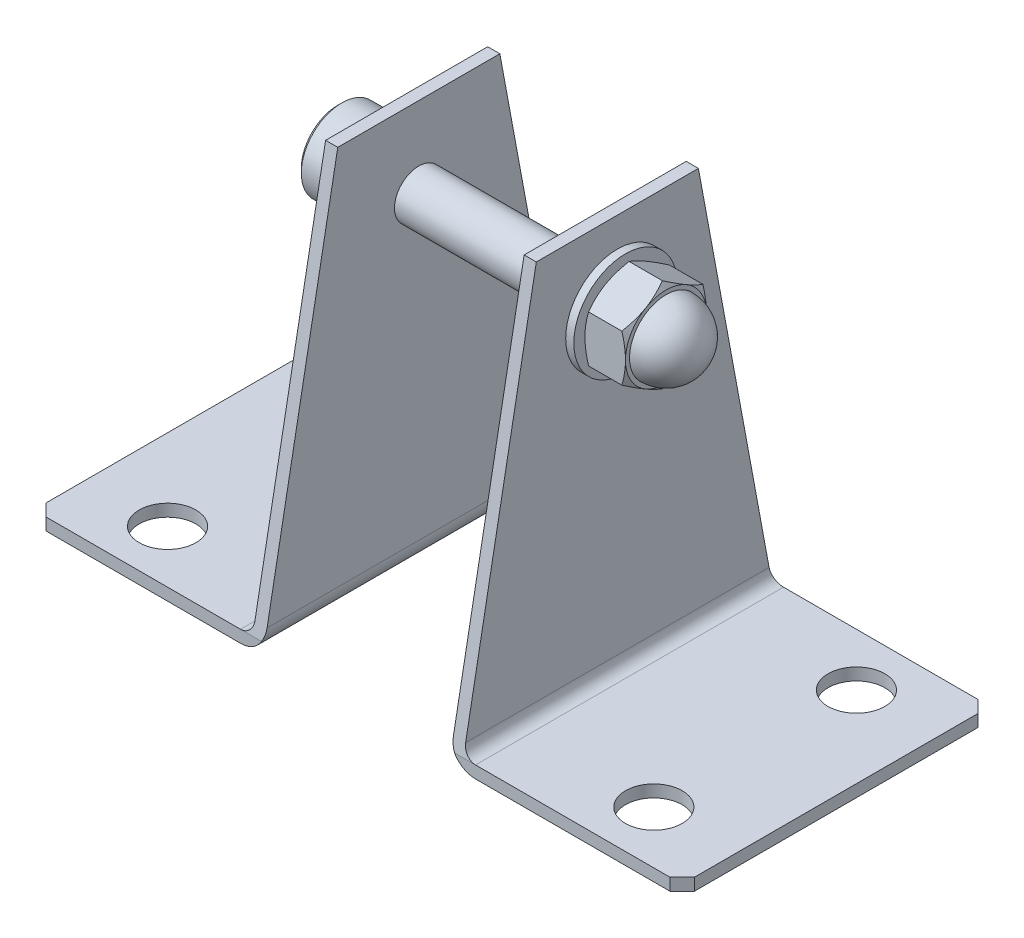
from build123d import *
from build123d.topology import SkipClean

# Parameters (mm, degrees)
BOSS_EXTRUDE1_DEPTH     = 19
BOSS_EXTRUDE1_2_DEPTH   = 19
CUT_EXTRUDE1_DEPTH      = 67.790717918
CUT_EXTRUDE1_DEPTH_BACK = 67.790717918
SKETCH3_R               = 3
CUT_EXTRUDE2_DEPTH      = 76.299402388
SKETCH4_R               = 3.5
CUT_EXTRUDE3_DEPTH      = 66.675337837
CHAMFER1_SIZE           = 1.5
CHAMFER2_SIZE           = 1.5
SKETCH5_W               = 1
SKETCH5_H               = 3.375
BOSS_EXTRUDE2_DEPTH     = 5
CUT_EXTRUDE4_DEPTH      = 3
CHAMFER3_SIZE           = 0.5


with BuildPart() as part:
    # Sketch1 → Boss-Extrude1 (new, symmetric)
    with BuildSketch(Plane.XY):
        with BuildLine():
            Line((-40, 0), (-14.5, 0))
            ThreePointArc((-14.5, 0), (-12.378679656, 0.878679656), (-11.5, 3))
            Line((-11.5, 3), (-11.5, 50))
            Line((-11.5, 50), (-13, 50))
            Line((-13, 50), (-13, 3))
            ThreePointArc((-13, 3), (-13.439339828, 1.939339828), (-14.5, 1.5))
            Line((-14.5, 1.5), (-40, 1.5))
            Line((-40, 1.5), (-40, 0))
        make_face()
    extrude(amount=BOSS_EXTRUDE1_DEPTH, both=True)


with BuildPart() as body_2:
    # Sketch1 → Boss-Extrude1 2 (new, symmetric)
    with BuildSketch(Plane.XY):
        with BuildLine():
            Line((13, 50), (11.5, 50))
            Line((11.5, 50), (11.5, 3))
            ThreePointArc((11.5, 3), (12.378679656, 0.878679656), (14.5, 0))
            Line((14.5, 0), (40, 0))
            Line((40, 0), (40, 1.5))
            Line((40, 1.5), (14.5, 1.5))
            ThreePointArc((14.5, 1.5), (13.439339828, 1.939339828), (13, 3))
            Line((13, 3), (13, 50))
        make_face()
    extrude(amount=BOSS_EXTRUDE1_2_DEPTH, both=True)


with BuildPart() as cut_extrude1_tool:
    # Sketch2 → Cut-Extrude1 (new, two sides: drawn at the far end of the back side and taken through both)
    with BuildSketch(Plane(origin=(0, 0, 0), x_dir=(0, 0, -1), z_dir=(1, 0, 0)).offset(-CUT_EXTRUDE1_DEPTH_BACK)):
        Polygon((-19, 50), (-10, 50), (-19, 1.5), align=None)
        Polygon((10, 50), (19, 50), (19, 1.5), align=None)
    extrude(amount=CUT_EXTRUDE1_DEPTH + CUT_EXTRUDE1_DEPTH_BACK)


with BuildPart() as part_1:
    add(part.part)

    # Cut-Extrude1: cut by cut_extrude1_tool
    add(cut_extrude1_tool.part, mode=Mode.SUBTRACT)


with BuildPart() as body_2_1:
    add(body_2.part)

    # Cut-Extrude1: cut by cut_extrude1_tool
    add(cut_extrude1_tool.part, mode=Mode.SUBTRACT)


with BuildPart() as cut_extrude2_tool:
    # Sketch3 → Cut-Extrude2 (new, through all)
    with BuildSketch(Plane(origin=(13, 0, 0), x_dir=(0, 0, -1), z_dir=(1, 0, 0))):
        with Locations((0, 40)):
            Circle(SKETCH3_R)
    extrude(amount=-CUT_EXTRUDE2_DEPTH)


with BuildPart() as part_2:
    add(part_1.part)

    # Cut-Extrude2: cut by cut_extrude2_tool
    add(cut_extrude2_tool.part, mode=Mode.SUBTRACT)


with BuildPart() as body_2_2:
    add(body_2_1.part)

    # Cut-Extrude2: cut by cut_extrude2_tool
    add(cut_extrude2_tool.part, mode=Mode.SUBTRACT)


with BuildPart() as cut_extrude3_tool:
    # Sketch4 → Cut-Extrude3 (new, through all)
    with BuildSketch(Plane(origin=(0, 1.5, 0), x_dir=(1, 0, 0), z_dir=(0, 1, 0))):
        with Locations(Location((-30, 12.5, 0), (0, 0, 270))):
            Circle(SKETCH4_R)
        with Locations(Location((-30, -12.5, 0), (0, 0, 270))):
            Circle(SKETCH4_R)
        with Locations(Location((30, 12.5, 0), (0, 0, 270))):
            Circle(SKETCH4_R)
        with Locations(Location((30, -12.5, 0), (0, 0, 270))):
            Circle(SKETCH4_R)
    extrude(amount=-CUT_EXTRUDE3_DEPTH)


with BuildPart() as part_3:
    add(part_2.part)

    # Cut-Extrude3: cut by cut_extrude3_tool
    add(cut_extrude3_tool.part, mode=Mode.SUBTRACT)

    # Chamfer1
    chamfer1_edges = [part_3.edges().sort_by_distance(p)[0] for p in [
        (-40, 0.75, -19),
        (-40, 0.75, 19),
    ]]
    chamfer(chamfer1_edges, length=CHAMFER1_SIZE)



with BuildPart() as body_2_3:
    add(body_2_2.part)

    # Cut-Extrude3: cut by cut_extrude3_tool
    add(cut_extrude3_tool.part, mode=Mode.SUBTRACT)

    # Chamfer2
    chamfer2_edges = [body_2_3.edges().sort_by_distance(p)[0] for p in [
        (40, 0.75, 19),
        (40, 0.75, -19),
    ]]
    chamfer(chamfer2_edges, length=CHAMFER2_SIZE)


with BuildPart() as part_4:
    with SkipClean():  # the faces are left unmerged after this step: merging them gives an invalid solid
        add(part_3.part)

        add(body_2_3.part)  # Revolve1 merges body 2
        # Sketch5 → Revolve1 (revolve)
        with BuildSketch(Plane.XY, mode=Mode.PRIVATE) as revolve1_sk:
            with Locations((-13.5, 44.6875)):
                Rectangle(SKETCH5_W, SKETCH5_H)
            with Locations((13.5, 44.6875)):
                Rectangle(SKETCH5_W, SKETCH5_H)
        revolve(revolve1_sk.sketch.rotate(Axis((-14, 40, 0), (1, 0, 0)), 90), axis=Axis((-14, 40, 0), (1, 0, 0)))


with BuildPart() as body_2_2_1:
    # Sketch6 → Revolve2 (revolve)
    with BuildSketch(Plane.XY, mode=Mode.PRIVATE) as revolve2_sk:
        with BuildLine():
            Line((-21.5, 40), (23.5, 40))
            ThreePointArc((23.5, 40), (22.181980515, 43.181980515), (19, 44.5))
            Line((19, 44.5), (19, 45))
            Line((19, 45), (14, 45))
            Line((14, 45), (14, 43))
            Line((14, 43), (-14, 43))
            Line((-14, 43), (-14, 46.1))
            Line((-14, 46.1), (-15.5, 46.1))
            Line((-15.5, 46.1), (-15.5, 45))
            Line((-15.5, 45), (-21.5, 45))
            Line((-21.5, 45), (-21.5, 40))
        make_face()
    revolve(revolve2_sk.sketch.rotate(Axis((-21.5, 40, 0), (1, 0, 0)), 180), axis=Axis((-21.5, 40, 0), (1, 0, 0)))

    # Sketch7 → Boss-Extrude2 (add)
    with BuildSketch(Plane(origin=(14, 0, 0), x_dir=(0, 0, -1), z_dir=(1, 0, 0))):
        Polygon((0, 34.226497308), (5, 37.113248654), (5, 42.886751346), (0, 45.773502692), (-5, 42.886751346), (-5, 37.113248654), align=None)
    extrude(amount=BOSS_EXTRUDE2_DEPTH)

    # Sketch8 → Cut-Revolve1 (revolve, cut)
    with BuildSketch(Plane.XY, mode=Mode.PRIVATE) as cut_revolve1_sk:
        Polygon((18.553418013, 45.773502692), (19, 45.773502692), (19, 45), align=None)
        Polygon((14.446581987, 45.773502692), (14, 45.773502692), (14, 45), align=None)
        Polygon((-21.5, 40), (-17.056624327, 40), (-18.5, 42.5), (-21.5, 42.5), align=None)
    revolve(cut_revolve1_sk.sketch.rotate(Axis((-21.5, 40, 0), (1, 0, 0)), 90), axis=Axis((-21.5, 40, 0), (1, 0, 0)), mode=Mode.SUBTRACT)

    # Sketch9 → Cut-Extrude4 (cut)
    with BuildSketch(Plane.ZY.offset(21.5)):
        Polygon((2.886751346, 40), (1.443375673, 42.5), (-1.443375673, 42.5), (-2.886751346, 40), (-1.443375673, 37.5), (1.443375673, 37.5), align=None)
    extrude(amount=-CUT_EXTRUDE4_DEPTH, mode=Mode.SUBTRACT)

    # Chamfer3
    chamfer3_edges = [body_2_2_1.edges().sort_by_distance(p)[0] for p in [
        (-21.5, 45, 0),
    ]]
    chamfer(chamfer3_edges, length=CHAMFER3_SIZE)


solid = Compound([part_4.part, body_2_2_1.part])
